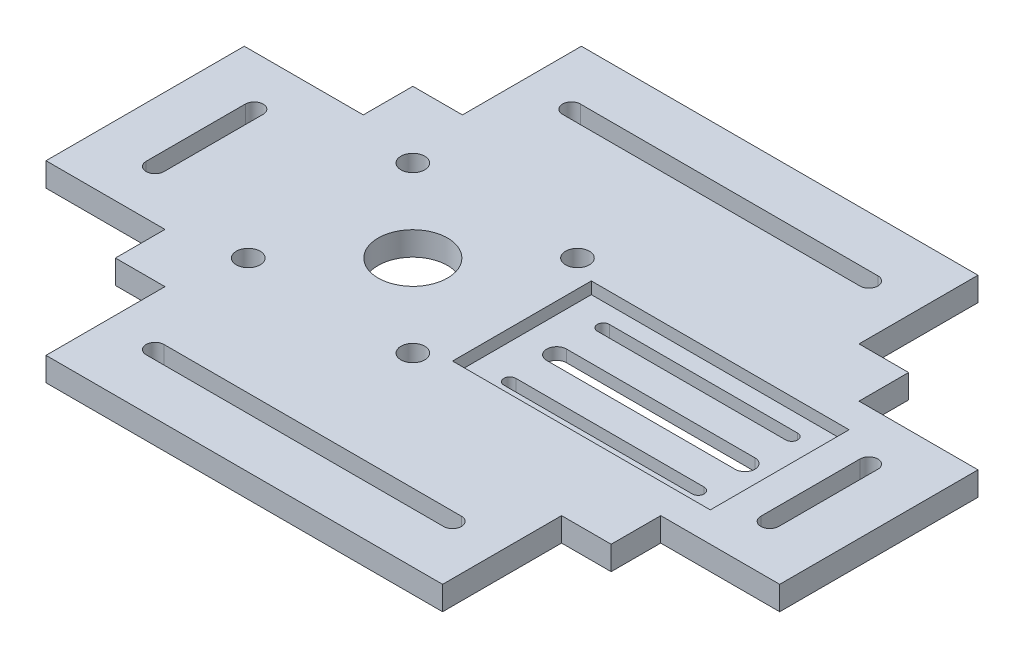
from build123d import *

# Parameters (mm, degrees)
SKETCH1_R           = 17.5
SKETCH1_R_2         = 6
BOSS_EXTRUDE1_DEPTH = 12
CUT_EXTRUDE1_START  = -6
SKETCH2_W           = 130
SKETCH2_H           = 70
CUT_EXTRUDE1_DEPTH  = 6


with BuildPart() as part:
    # Sketch1 → Boss-Extrude1 (new body)
    with BuildSketch(Plane(origin=(0, 0, 0), x_dir=(1, 0, 0), z_dir=(0, 1, 0))):
        Polygon((0, 0), (25, 0), (25, -60), (225, -60), (225, 0), (250, 0), (250, 25), (310, 25), (310, 125), (250, 125), (250, 150), (225, 150), (225, 210), (25, 210), (25, 150), (0, 150), (0, 125), (-60, 125), (-60, 25), (0, 25), align=None)
        with Locations(Location((75, 75, 0), (0, 0, 270))):
            Circle(SKETCH1_R, mode=Mode.SUBTRACT)
        with Locations(Location((33.5, 33.5, 0), (0, 0, 270))):
            Circle(SKETCH1_R_2, mode=Mode.SUBTRACT)
        with Locations(Location((116.5, 33.5, 0), (0, 0, 270))):
            Circle(SKETCH1_R_2, mode=Mode.SUBTRACT)
        with Locations(Location((116.5, 116.5, 0), (0, 0, 270))):
            Circle(SKETCH1_R_2, mode=Mode.SUBTRACT)
        with Locations(Location((33.5, 116.5, 0), (0, 0, 270))):
            Circle(SKETCH1_R_2, mode=Mode.SUBTRACT)
        with BuildLine():
            Line((-25.5, 100), (-25.5, 50))
            ThreePointArc((-25.5, 50), (-30, 45.5), (-34.5, 50))
            Line((-34.5, 50), (-34.5, 100))
            ThreePointArc((-34.5, 100), (-30, 104.5), (-25.5, 100))
        make_face(mode=Mode.SUBTRACT)
        with BuildLine():
            Line((50, 184.5), (200, 184.5))
            ThreePointArc((200, 184.5), (204.5, 180), (200, 175.5))
            Line((200, 175.5), (50, 175.5))
            ThreePointArc((50, 175.5), (45.5, 180), (50, 184.5))
        make_face(mode=Mode.SUBTRACT)
        with BuildLine():
            Line((50, -25.5), (200, -25.5))
            ThreePointArc((200, -25.5), (204.5, -30), (200, -34.5))
            Line((200, -34.5), (50, -34.5))
            ThreePointArc((50, -34.5), (45.5, -30), (50, -25.5))
        make_face(mode=Mode.SUBTRACT)
        with BuildLine():
            Line((275.5, 50), (275.5, 100))
            ThreePointArc((275.5, 100), (280, 104.5), (284.5, 100))
            Line((284.5, 100), (284.5, 50))
            ThreePointArc((284.5, 50), (280, 45.5), (275.5, 50))
        make_face(mode=Mode.SUBTRACT)
        with BuildLine():
            Line((147.5, 54.43), (242.5, 54.43))
            ThreePointArc((242.5, 54.43), (245.5, 51.43), (242.5, 48.43))
            Line((242.5, 48.43), (147.5, 48.43))
            ThreePointArc((147.5, 48.43), (144.5, 51.43), (147.5, 54.43))
        make_face(mode=Mode.SUBTRACT)
        with BuildLine():
            Line((147.5, 101.57), (242.5, 101.57))
            ThreePointArc((242.5, 101.57), (245.5, 98.57), (242.5, 95.57))
            Line((242.5, 95.57), (147.5, 95.57))
            ThreePointArc((147.5, 95.57), (144.5, 98.57), (147.5, 101.57))
        make_face(mode=Mode.SUBTRACT)
        with BuildLine():
            Line((147.5, 80), (242.5, 80))
            ThreePointArc((242.5, 80), (247.5, 75), (242.5, 70))
            Line((242.5, 70), (147.5, 70))
            ThreePointArc((147.5, 70), (142.5, 75), (147.5, 80))
        make_face(mode=Mode.SUBTRACT)
    extrude(amount=BOSS_EXTRUDE1_DEPTH)

    # Sketch2 → Cut-Extrude1 (cut)
    with BuildSketch(Plane(origin=(0, 0, 0), x_dir=(-1, 0, 0), z_dir=(0, -1, 0)).offset(CUT_EXTRUDE1_START)):
        with Locations((-195, 75)):
            Rectangle(SKETCH2_W, SKETCH2_H)
    extrude(amount=-CUT_EXTRUDE1_DEPTH, mode=Mode.SUBTRACT)


solid = part.part
